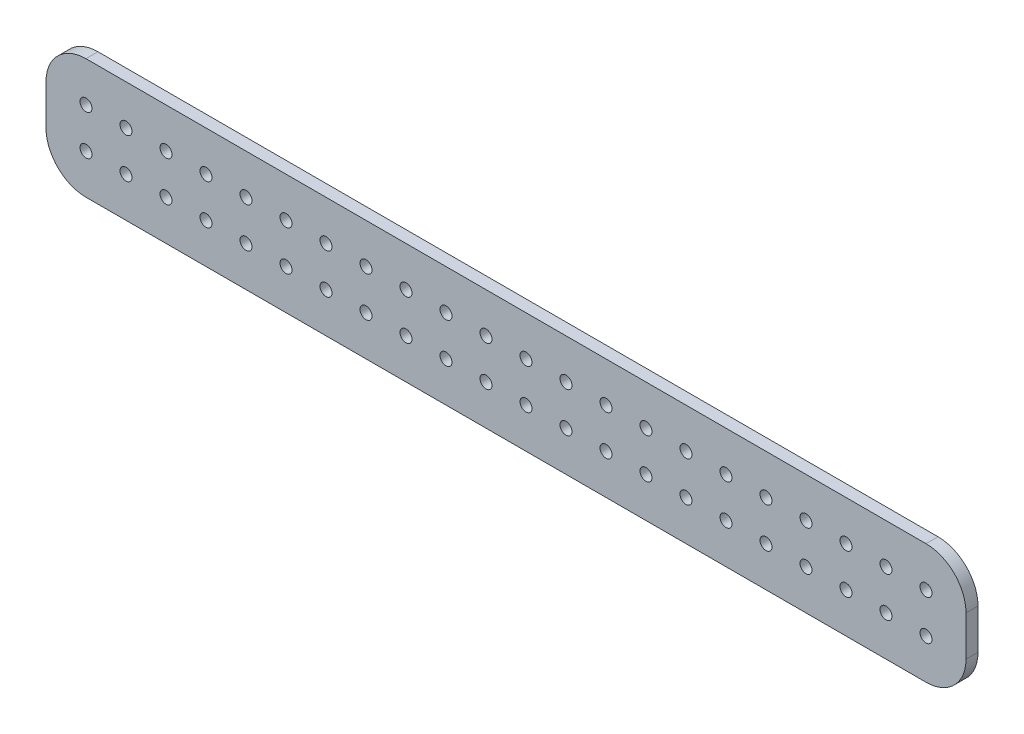
from build123d import *

# Parameters (mm, degrees)
SKETCH1_R           = 1.5
BOSS_EXTRUDE1_DEPTH = 3


with BuildPart() as part:
    # Sketch1 → Boss-Extrude1 (new body)
    with BuildSketch(Plane.XY):
        with BuildLine():
            Line((-105, 15), (105, 15))
            ThreePointArc((105, 15), (112.071067812, 12.071067812), (115, 5))
            Line((115, 5), (115, -5))
            ThreePointArc((115, -5), (112.071067812, -12.071067812), (105, -15))
            Line((105, -15), (-105, -15))
            ThreePointArc((-105, -15), (-112.071067812, -12.071067812), (-115, -5))
            Line((-115, -5), (-115, 5))
            ThreePointArc((-115, 5), (-112.071067812, 12.071067812), (-105, 15))
        make_face()
        with Locations((-105, 5)):
            Circle(SKETCH1_R, mode=Mode.SUBTRACT)
        with Locations((-95, 5)):
            Circle(SKETCH1_R, mode=Mode.SUBTRACT)
        with Locations((-85, 5)):
            Circle(SKETCH1_R, mode=Mode.SUBTRACT)
        with Locations((-75, 5)):
            Circle(SKETCH1_R, mode=Mode.SUBTRACT)
        with Locations((-65, 5)):
            Circle(SKETCH1_R, mode=Mode.SUBTRACT)
        with Locations((-55, 5)):
            Circle(SKETCH1_R, mode=Mode.SUBTRACT)
        with Locations((-45, 5)):
            Circle(SKETCH1_R, mode=Mode.SUBTRACT)
        with Locations((-35, 5)):
            Circle(SKETCH1_R, mode=Mode.SUBTRACT)
        with Locations((-25, 5)):
            Circle(SKETCH1_R, mode=Mode.SUBTRACT)
        with Locations((-15, 5)):
            Circle(SKETCH1_R, mode=Mode.SUBTRACT)
        with Locations((-5, 5)):
            Circle(SKETCH1_R, mode=Mode.SUBTRACT)
        with Locations((15, 5)):
            Circle(SKETCH1_R, mode=Mode.SUBTRACT)
        with Locations((25, 5)):
            Circle(SKETCH1_R, mode=Mode.SUBTRACT)
        with Locations((5, 5)):
            Circle(SKETCH1_R, mode=Mode.SUBTRACT)
        with Locations((35, 5)):
            Circle(SKETCH1_R, mode=Mode.SUBTRACT)
        with Locations((45, 5)):
            Circle(SKETCH1_R, mode=Mode.SUBTRACT)
        with Locations((55, 5)):
            Circle(SKETCH1_R, mode=Mode.SUBTRACT)
        with Locations((65, 5)):
            Circle(SKETCH1_R, mode=Mode.SUBTRACT)
        with Locations((75, 5)):
            Circle(SKETCH1_R, mode=Mode.SUBTRACT)
        with Locations((85, 5)):
            Circle(SKETCH1_R, mode=Mode.SUBTRACT)
        with Locations((95, 5)):
            Circle(SKETCH1_R, mode=Mode.SUBTRACT)
        with Locations((-85, -5)):
            Circle(SKETCH1_R, mode=Mode.SUBTRACT)
        with Locations((-75, -5)):
            Circle(SKETCH1_R, mode=Mode.SUBTRACT)
        with Locations((-65, -5)):
            Circle(SKETCH1_R, mode=Mode.SUBTRACT)
        with Locations((-55, -5)):
            Circle(SKETCH1_R, mode=Mode.SUBTRACT)
        with Locations((-45, -5)):
            Circle(SKETCH1_R, mode=Mode.SUBTRACT)
        with Locations((-35, -5)):
            Circle(SKETCH1_R, mode=Mode.SUBTRACT)
        with Locations((-25, -5)):
            Circle(SKETCH1_R, mode=Mode.SUBTRACT)
        with Locations((-15, -5)):
            Circle(SKETCH1_R, mode=Mode.SUBTRACT)
        with Locations((-5, -5)):
            Circle(SKETCH1_R, mode=Mode.SUBTRACT)
        with Locations((5, -5)):
            Circle(SKETCH1_R, mode=Mode.SUBTRACT)
        with Locations((15, -5)):
            Circle(SKETCH1_R, mode=Mode.SUBTRACT)
        with Locations((35, -5)):
            Circle(SKETCH1_R, mode=Mode.SUBTRACT)
        with Locations((45, -5)):
            Circle(SKETCH1_R, mode=Mode.SUBTRACT)
        with Locations((25, -5)):
            Circle(SKETCH1_R, mode=Mode.SUBTRACT)
        with Locations((55, -5)):
            Circle(SKETCH1_R, mode=Mode.SUBTRACT)
        with Locations((65, -5)):
            Circle(SKETCH1_R, mode=Mode.SUBTRACT)
        with Locations((75, -5)):
            Circle(SKETCH1_R, mode=Mode.SUBTRACT)
        with Locations((85, -5)):
            Circle(SKETCH1_R, mode=Mode.SUBTRACT)
        with Locations((95, -5)):
            Circle(SKETCH1_R, mode=Mode.SUBTRACT)
        with Locations((105, -5)):
            Circle(SKETCH1_R, mode=Mode.SUBTRACT)
        with Locations((105, 5)):
            Circle(SKETCH1_R, mode=Mode.SUBTRACT)
        with Locations((-105, -5)):
            Circle(SKETCH1_R, mode=Mode.SUBTRACT)
        with Locations((-95, -5)):
            Circle(SKETCH1_R, mode=Mode.SUBTRACT)
    extrude(amount=BOSS_EXTRUDE1_DEPTH)


solid = part.part
